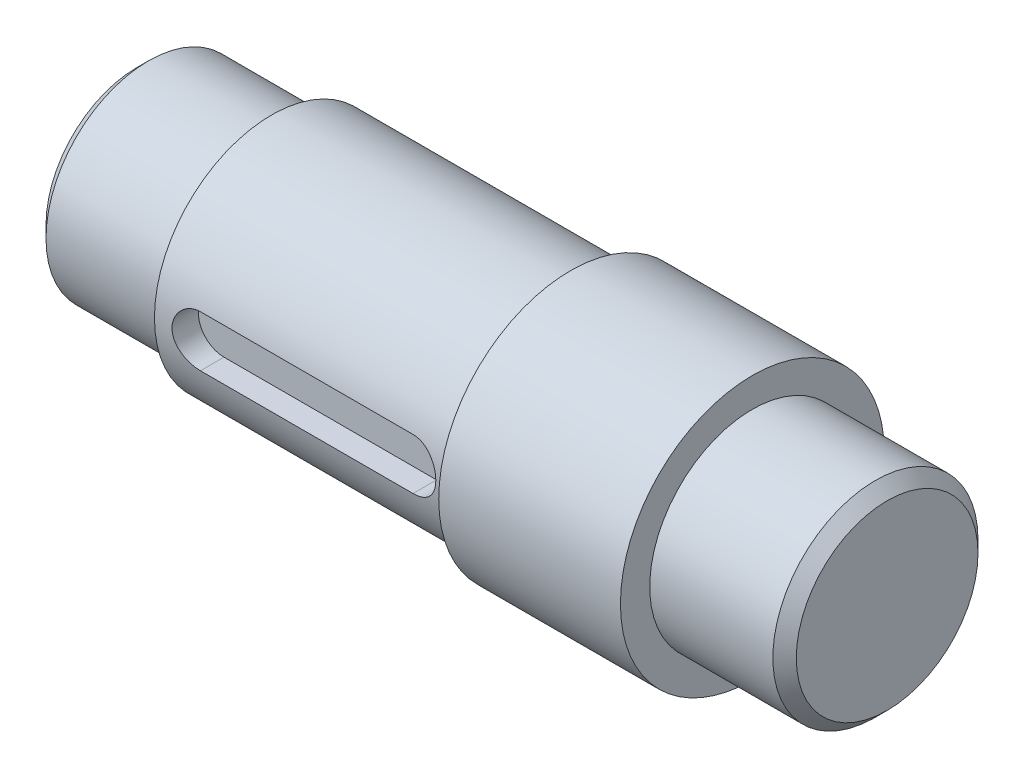
from build123d import *

# Parameters (mm, degrees)
SKETCH_1_R          = 22.5
EXTRUDE_1_DEPTH     = 128
SKETCH_2_OUTSIDE_W  = 75.59
SKETCH_2_OUTSIDE_H  = 75.59
SKETCH_2_OUTSIDE_R  = 17.5
CUT_EXTRUDE_1_DEPTH = 23
SKETCH_3_OUTSIDE_W  = 75.59
SKETCH_3_OUTSIDE_H  = 75.59
SKETCH_3_OUTSIDE_R  = 20
CUT_EXTRUDE_2_DEPTH = 74
SKETCH_4_OUTSIDE_W  = 75.59
SKETCH_4_OUTSIDE_H  = 75.59
SKETCH_4_OUTSIDE_R  = 17.5
CUT_EXTRUDE_3_DEPTH = 23
CUT_EXTRUDE_START   = 15.5
CUT_EXTRUDE_4_DEPTH = 117.3957922
CHAMFER_1_SIZE      = 2


with BuildPart() as part:
    # 草图1 → 凸台-拉伸1 (new body)
    with BuildSketch(Plane(origin=(0, 0, 0), x_dir=(0, 0, -1), z_dir=(1, 0, 0))):
        Circle(SKETCH_1_R)
    extrude(amount=EXTRUDE_1_DEPTH)

    # 草图2 outside → 切除-拉伸1 (cut)
    with BuildSketch(Plane(origin=(128, 0, 0), x_dir=(0, 0, -1), z_dir=(1, 0, 0))):
        Rectangle(SKETCH_2_OUTSIDE_W, SKETCH_2_OUTSIDE_H)
        Circle(SKETCH_2_OUTSIDE_R, mode=Mode.SUBTRACT)
    extrude(amount=-CUT_EXTRUDE_1_DEPTH, mode=Mode.SUBTRACT)

    # 草图3 outside → 切除-拉伸2 (cut)
    with BuildSketch(Plane.ZY):
        Rectangle(SKETCH_3_OUTSIDE_W, SKETCH_3_OUTSIDE_H)
        Circle(SKETCH_3_OUTSIDE_R, mode=Mode.SUBTRACT)
    extrude(amount=-CUT_EXTRUDE_2_DEPTH, mode=Mode.SUBTRACT)

    # 草图4 outside → 切除-拉伸3 (cut)
    with BuildSketch(Plane.ZY):
        Rectangle(SKETCH_4_OUTSIDE_W, SKETCH_4_OUTSIDE_H)
        with Locations(Location((0, 0, 0), (0, 0, 180))):
            Circle(SKETCH_4_OUTSIDE_R, mode=Mode.SUBTRACT)
    extrude(amount=-CUT_EXTRUDE_3_DEPTH, mode=Mode.SUBTRACT)

    # 草图5 → 切除-拉伸4 (cut, through all)
    with BuildSketch(Plane.XY.offset(CUT_EXTRUDE_START)):
        with BuildLine():
            Line((30.362609491, 4.362609491), (66.637390509, 4.362609491))
            ThreePointArc((66.637390509, 4.362609491), (71, 0), (66.637390509, -4.362609491))
            Line((66.637390509, -4.362609491), (30.362609491, -4.362609491))
            ThreePointArc((30.362609491, -4.362609491), (26, 0), (30.362609491, 4.362609491))
        make_face()
    extrude(amount=CUT_EXTRUDE_4_DEPTH, mode=Mode.SUBTRACT)

    # 倒角1
    chamfer_1_edges = [part.edges().sort_by_distance(p)[0] for p in [
        (128, 0, 17.5),
        (0, 0, 17.5),
    ]]
    chamfer(chamfer_1_edges, length=CHAMFER_1_SIZE)


solid = part.part
